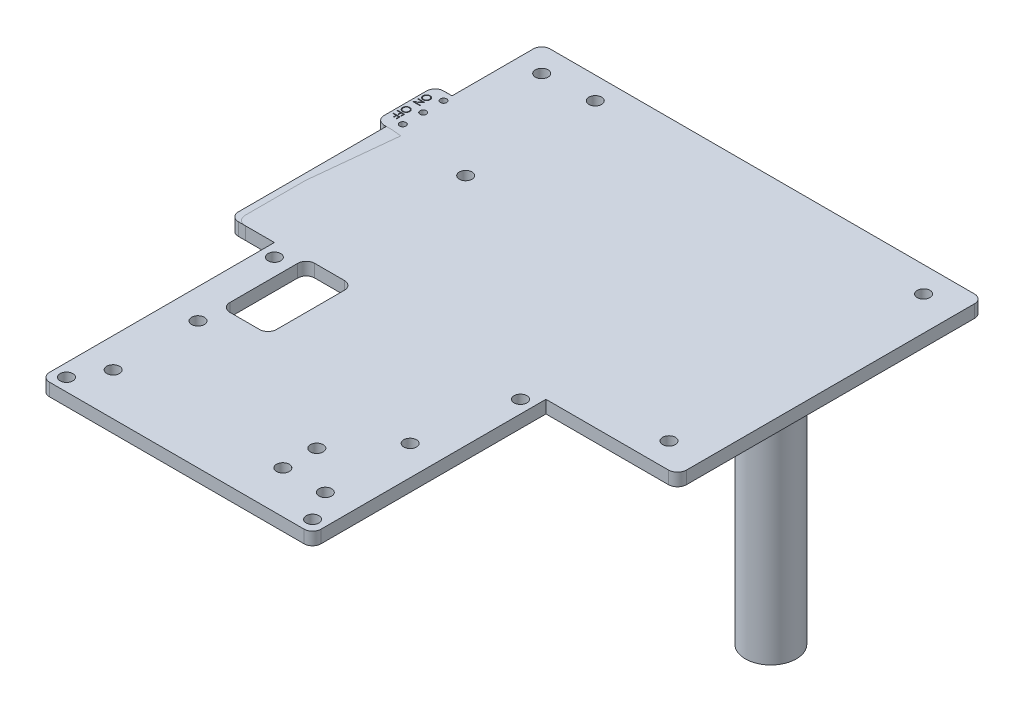
from build123d import *

# Parameters (mm, degrees)
SKETCH1_R           = 1.5
BOSS_EXTRUDE1_DEPTH = 3
BOSS_EXTRUDE2_DEPTH = 3
SKETCH3_R           = 1.5
CUT_EXTRUDE1_DEPTH  = 3
SKETCH4_R           = 6
SKETCH4_R_2         = 1.5
BOSS_EXTRUDE3_DEPTH = 50
SKETCH8_R           = 1.5
CUT_EXTRUDE3_DEPTH  = 130.144299139
SKETCH5_R           = 1.5
CUT_EXTRUDE4_DEPTH  = 130.144299139
SKETCH10_W          = 9
SKETCH10_H          = 4
CUT_EXTRUDE5_DEPTH  = 9
SKETCH11_R          = 1.5
BOSS_EXTRUDE4_DEPTH = 40
SKETCH13_R          = 0.75
BOSS_EXTRUDE6_DEPTH = 3
SKETCH17_R          = 0.75
CUT_EXTRUDE9_DEPTH  = 3
CUT_EXTRUDE10_DEPTH = 3
CUT_EXTRUDE11_DEPTH = 3
SKETCH22_R          = 1.5
CUT_EXTRUDE12_DEPTH = 3
BOSS_EXTRUDE8_DEPTH = 3


with BuildPart() as part:
    # Sketch1 → Boss-Extrude1 (new body)
    with BuildSketch(Plane(origin=(0, 0, 0), x_dir=(1, 0, 0), z_dir=(0, 1, 0))):
        with BuildLine():
            Line((30, 27.5), (-30, 27.5))
            Line((-30, 27.5), (-32, 27.5))
            Line((-32, 27.5), (-32, 25.5))
            Line((-32, 25.5), (-32, -25.5))
            ThreePointArc((-32, -25.5), (-31.414213562, -26.914213562), (-30, -27.5))
            Line((-30, -27.5), (30, -27.5))
            ThreePointArc((30, -27.5), (31.414213562, -26.914213562), (32, -25.5))
            Line((32, -25.5), (32, 25.5))
            Line((32, 25.5), (32, 27.5))
            Line((32, 27.5), (30, 27.5))
        make_face()
        with Locations((-29, 24.5)):
            Circle(SKETCH1_R, mode=Mode.SUBTRACT)
        with Locations((29, 24.5)):
            Circle(SKETCH1_R, mode=Mode.SUBTRACT)
        with Locations((29, -24.5)):
            Circle(SKETCH1_R, mode=Mode.SUBTRACT)
        with Locations((-29, -24.5)):
            Circle(SKETCH1_R, mode=Mode.SUBTRACT)
    extrude(amount=BOSS_EXTRUDE1_DEPTH)

    # Sketch2 → Boss-Extrude2 (add)
    with BuildSketch(Plane(origin=(0, 3, 0), x_dir=(1, 0, 0), z_dir=(0, 1, 0))):
        with BuildLine():
            Line((-41, 97.5), (-41, 29.649557683))
            ThreePointArc((-41, 29.649557683), (-40.370409131, 28.129590869), (-38.850442317, 27.5))
            Line((-38.850442317, 27.5), (-32, 27.5))
            Line((-32, 27.5), (-30, 27.5))
            Line((-30, 27.5), (30, 27.5))
            Line((30, 27.5), (32, 27.5))
            Line((32, 27.5), (60.850442317, 27.5))
            ThreePointArc((60.850442317, 27.5), (62.370409131, 28.129590869), (63, 29.649557683))
            Line((63, 29.649557683), (63, 97.5))
            ThreePointArc((63, 97.5), (62.414213562, 98.914213562), (61, 99.5))
            Line((61, 99.5), (-39, 99.5))
            ThreePointArc((-39, 99.5), (-40.414213562, 98.914213562), (-41, 97.5))
        make_face()
    extrude(amount=-BOSS_EXTRUDE2_DEPTH)

    # Sketch3 → Cut-Extrude1 (cut)
    with BuildSketch(Plane(origin=(0, 3, 0), x_dir=(1, 0, 0), z_dir=(0, 1, 0))):
        with Locations((-36.5, 57)):
            Circle(SKETCH3_R)
        with Locations((55.5, 57)):
            Circle(SKETCH3_R)
    extrude(amount=-CUT_EXTRUDE1_DEPTH, mode=Mode.SUBTRACT)

    # Sketch4 → Boss-Extrude3 (add)
    # profile 1 of 2: a face of its own
    with BuildSketch(Plane.XZ):
        with Locations((-36.5, -57)):
            Circle(SKETCH4_R)
        with Locations((-36.5, -57)):
            Circle(SKETCH4_R_2, mode=Mode.SUBTRACT)
    # profile 2 of 2: a face of its own
    with BuildSketch(Plane.XZ):
        with Locations((55.5, -57)):
            Circle(SKETCH4_R)
        with Locations((55.5, -57)):
            Circle(SKETCH4_R_2, mode=Mode.SUBTRACT)
    extrude(amount=BOSS_EXTRUDE3_DEPTH)

    # Sketch8 → Cut-Extrude3 (cut, through all)
    with BuildSketch(Plane(origin=(0, 3, 0), x_dir=(1, 0, 0), z_dir=(0, 1, 0))):
        with Locations((-25, 2.5)):
            Circle(SKETCH8_R)
        with Locations((-25, -17.5)):
            Circle(SKETCH8_R)
        with Locations((25, -17.5)):
            Circle(SKETCH8_R)
        with Locations((25, 2.5)):
            Circle(SKETCH8_R)
    extrude(amount=-CUT_EXTRUDE3_DEPTH, mode=Mode.SUBTRACT)

    # Sketch5 → Cut-Extrude4 (cut, through all)
    with BuildSketch(Plane(origin=(0, 3, 0), x_dir=(1, 0, 0), z_dir=(0, 1, 0))):
        with Locations((55, 33.5)):
            Circle(SKETCH5_R)
        with Locations((55, 93.5)):
            Circle(SKETCH5_R)
        with Locations((-23.11, 63.7)):
            Circle(SKETCH5_R)
        with Locations((-35, 93.5)):
            Circle(SKETCH5_R)
        with Locations((-23.11, 94.24)):
            Circle(SKETCH5_R)
    extrude(amount=-CUT_EXTRUDE4_DEPTH, mode=Mode.SUBTRACT)

    # Sketch10 → Cut-Extrude5 (cut)
    with BuildSketch(Plane(origin=(0, 0, -63), x_dir=(-1, 0, 0), z_dir=(0, 0, -1))):
        with Locations((-55.5, -42)):
            Rectangle(SKETCH10_W, SKETCH10_H)
        with Locations((35.5, -42)):
            Rectangle(SKETCH10_W, SKETCH10_H)
    extrude(amount=-CUT_EXTRUDE5_DEPTH, mode=Mode.SUBTRACT)

    # Sketch11 → Boss-Extrude4 (add)
    with BuildSketch(Plane(origin=(0, 3, 0), x_dir=(1, 0, 0), z_dir=(0, 1, 0))):
        with Locations((55.5, 57)):
            Circle(SKETCH11_R)
        with Locations((-36.5, 57)):
            Circle(SKETCH11_R)
    extrude(amount=-BOSS_EXTRUDE4_DEPTH)

    # Sketch13 → Boss-Extrude6 (add)
    with BuildSketch(Plane(origin=(0, 3, 0), x_dir=(1, 0, 0), z_dir=(0, 1, 0))):
        with BuildLine():
            Line((-37, 78.374778842), (-43, 78.374778842))
            ThreePointArc((-43, 78.374778842), (-44.414213562, 77.788992404), (-45, 76.374778842))
            Line((-45, 76.374778842), (-45, 66.374778842))
            ThreePointArc((-45, 66.374778842), (-44.414213562, 64.960565279), (-43, 64.374778842))
            Line((-43, 64.374778842), (-37, 64.374778842))
            Line((-37, 64.374778842), (-37, 78.374778842))
        make_face()
        with Locations((-41, 71.574778842)):
            Circle(SKETCH13_R, mode=Mode.SUBTRACT)
        with Locations((-41, 76.374778842)):
            Circle(SKETCH13_R, mode=Mode.SUBTRACT)
        with Locations((-41, 66.774778842)):
            Circle(SKETCH13_R, mode=Mode.SUBTRACT)
    extrude(amount=-BOSS_EXTRUDE6_DEPTH)

    # Sketch17 → Cut-Extrude9 (cut)
    with BuildSketch(Plane(origin=(0, 3, 0), x_dir=(1, 0, 0), z_dir=(0, 1, 0))):
        with Locations((-41, 76.374778842)):
            Circle(SKETCH17_R)
        with Locations((-41, 71.574778842)):
            Circle(SKETCH17_R)
        with Locations((-41, 66.774778842)):
            Circle(SKETCH17_R)
    extrude(amount=-CUT_EXTRUDE9_DEPTH, mode=Mode.SUBTRACT)

    # Sketch18 → Cut-Extrude10 (cut)
    # profile 1 of 5: a face of its own
    with BuildSketch(Plane(origin=(0, 3, 0), x_dir=(1, 0, 0), z_dir=(0, 1, 0))):
        with BuildLine():
            add(Edge.make_bspline(
                [(-42.773187921, 74.988992404), (-42.773938319, 74.959365847), (-42.775412161, 74.901176845), (-42.78669394, 74.815656807), (-42.806212188, 74.734013646), (-42.832205396, 74.65558045), (-42.866886483, 74.581302128), (-42.908781713, 74.51059439), (-42.958486936, 74.443657155), (-43.015168119, 74.381103983), (-43.077064363, 74.324072038), (-43.143309232, 74.27424362), (-43.212995607, 74.23211407), (-43.286365977, 74.197583431), (-43.363097414, 74.170469322), (-43.443626198, 74.151765157), (-43.527423203, 74.139815828), (-43.584578388, 74.138418965), (-43.613572537, 74.137710353)],
                knots=[0, 0, 0, 0, 1.06508495, 2.091914715, 3.094501328, 4.079693967, 5.057647778, 6.035986298, 7.030177474, 8.050107388, 9.066943579, 10.051896531, 11.025616101, 11.9896488, 12.96281505, 13.945825876, 14.957941789, 16, 16, 16, 16], degree=3))
            add(Edge.make_bspline(
                [(-43.613572537, 74.137710353), (-43.642353108, 74.13841886), (-43.69908295, 74.13981541), (-43.782348168, 74.151778757), (-43.862390936, 74.170538604), (-43.93906986, 74.197331913), (-44.01249466, 74.231696667), (-44.082309125, 74.274110952), (-44.14901268, 74.323609473), (-44.211209402, 74.380444292), (-44.268353386, 74.442325775), (-44.318259273, 74.50875745), (-44.360907539, 74.578375243), (-44.395201334, 74.651701259), (-44.422507336, 74.727918036), (-44.441142084, 74.807724096), (-44.453157663, 74.890763339), (-44.454537743, 74.947389971), (-44.455239203, 74.976171891)],
                knots=[0, 0, 0, 0, 1.04355943, 2.056976533, 3.044937463, 4.02179873, 4.997890911, 5.980248884, 6.980147982, 8.006253959, 9.032111064, 10.031228745, 11.015595249, 11.988180414, 12.962670953, 13.946861971, 14.95644057, 16, 16, 16, 16], degree=3))
            add(Edge.make_bspline(
                [(-44.455239203, 74.976171891), (-44.454531007, 75.005165922), (-44.453134964, 75.062320875), (-44.441164959, 75.146222707), (-44.422453933, 75.2268098), (-44.395688478, 75.303834027), (-44.361227494, 75.377320664), (-44.318880062, 75.447262604), (-44.268979429, 75.513743894), (-44.212220278, 75.576088008), (-44.150309055, 75.633062101), (-44.084314039, 75.683174106), (-44.014862879, 75.725277397), (-43.942241867, 75.759752928), (-43.866638715, 75.787021762), (-43.787577851, 75.805631402), (-43.705502296, 75.817670227), (-43.649619877, 75.819057649), (-43.621264844, 75.819761635)],
                knots=[0, 0, 0, 0, 1.053167129, 2.076072758, 3.073341244, 4.055601477, 5.033424535, 6.017524495, 7.021518915, 8.049444456, 9.077120685, 10.074910483, 11.055688766, 12.022980584, 12.991883888, 13.970269434, 14.970104079, 16, 16, 16, 16], degree=3))
            add(Edge.make_bspline(
                [(-43.621264844, 75.819761635), (-43.60223268, 75.819517454), (-43.564408451, 75.819032173), (-43.508242142, 75.813181245), (-43.452973045, 75.804708254), (-43.398786947, 75.792501612), (-43.345675, 75.776756079), (-43.29374582, 75.75735238), (-43.242571665, 75.735115734), (-43.193126469, 75.708639936), (-43.145332623, 75.679754047), (-43.099787751, 75.648256888), (-43.057305407, 75.613928845), (-43.017202968, 75.577260287), (-42.980164891, 75.537743638), (-42.94538366, 75.495973623), (-42.913219319, 75.451731682), (-42.884347407, 75.404947846), (-42.857828205, 75.356814886), (-42.835686853, 75.306983595), (-42.816116868, 75.256505363), (-42.800564533, 75.204935559), (-42.788187892, 75.152393471), (-42.779778277, 75.098813416), (-42.773914348, 75.044250581), (-42.773431105, 75.007491046), (-42.773187921, 74.988992404)],
                knots=[0, 0, 0, 0, 1.037115869, 2.061148057, 3.07517727, 4.084041727, 5.086514338, 6.092668487, 7.104487461, 8.125783165, 9.147610153, 10.147694368, 11.141876323, 12.122903372, 13.107606018, 14.091946891, 15.084523921, 16.086505767, 17.087268121, 18.077809654, 19.05670789, 20.036870126, 21.011670792, 21.99694167, 22.991993299, 24, 24, 24, 24], degree=3))
        make_face()
        with BuildLine():
            add(Edge.make_bspline(
                [(-42.937290485, 74.981941122), (-42.93747549, 74.997124989), (-42.937843731, 75.027347564), (-42.942697932, 75.072277126), (-42.949609547, 75.116618225), (-42.959493687, 75.160368449), (-42.972836917, 75.203292362), (-42.988559067, 75.245818616), (-43.007053795, 75.287743016), (-43.028619107, 75.328596877), (-43.052176869, 75.368311911), (-43.078032329, 75.406044498), (-43.106060116, 75.441418229), (-43.135890001, 75.47454642), (-43.167825491, 75.505332535), (-43.201356895, 75.53440063), (-43.237449495, 75.560580794), (-43.275122741, 75.584574259), (-43.314328057, 75.606045256), (-43.35465256, 75.625137994), (-43.396425218, 75.640755825), (-43.439192832, 75.653492912), (-43.482887671, 75.664052825), (-43.527841202, 75.670742619), (-43.573827539, 75.675648841), (-43.604904958, 75.675996199), (-43.620623819, 75.676171891)],
                knots=[0, 0, 0, 0, 1.008585988, 2.007529826, 2.999688727, 3.990042337, 4.984966365, 5.984641633, 7.001812546, 8.027570247, 9.052811818, 10.068991095, 11.064725446, 12.050001529, 13.029093193, 14.010961114, 14.996492974, 15.989185205, 16.977398719, 17.96520407, 18.951579521, 19.937648295, 20.929603947, 21.935788061, 22.955928099, 24, 24, 24, 24], degree=3))
            add(Edge.make_bspline(
                [(-43.620623819, 75.676171891), (-43.643737977, 75.675589097), (-43.689210676, 75.674442561), (-43.755847542, 75.664404815), (-43.819887902, 75.648943341), (-43.880981346, 75.626151402), (-43.939653018, 75.597648263), (-43.995382437, 75.562435971), (-44.048184666, 75.520717532), (-44.097691074, 75.473328491), (-44.142877728, 75.421523825), (-44.182541, 75.366514577), (-44.216099972, 75.308890071), (-44.243439433, 75.248500035), (-44.265103313, 75.185666875), (-44.279950688, 75.119985708), (-44.289722324, 75.05189407), (-44.290660727, 75.005480056), (-44.291136639, 74.981941122)],
                knots=[0, 0, 0, 0, 1.032063989, 2.030389145, 3.003944642, 3.970395727, 4.937377036, 5.913328081, 6.909231446, 7.93887556, 8.970685674, 9.976071282, 10.964166581, 11.944589148, 12.933237628, 13.927779006, 14.949070134, 16, 16, 16, 16], degree=3))
            add(Edge.make_bspline(
                [(-44.291136639, 74.981941122), (-44.290919267, 74.966119635), (-44.290488151, 74.934740875), (-44.286145889, 74.888068642), (-44.279182784, 74.842237206), (-44.269157211, 74.797310999), (-44.256610399, 74.75334046), (-44.241702215, 74.710144099), (-44.223111847, 74.668174411), (-44.202538737, 74.626930707), (-44.179253954, 74.587445096), (-44.153759902, 74.549982845), (-44.126233361, 74.51476114), (-44.096662515, 74.48170369), (-44.065302271, 74.450704262), (-44.031346306, 74.422604619), (-43.995786291, 74.396110821), (-43.958025172, 74.372213428), (-43.918737239, 74.350785119), (-43.878259992, 74.332151876), (-43.836732539, 74.316334212), (-43.794084495, 74.303567514), (-43.750399662, 74.293562565), (-43.705618792, 74.286668932), (-43.659831673, 74.281846777), (-43.628863052, 74.281483315), (-43.613252024, 74.281300096)],
                knots=[0, 0, 0, 0, 1.047226202, 2.076964084, 3.100341814, 4.114585567, 5.122123135, 6.126552355, 7.137064942, 8.158803602, 9.176592812, 10.169297945, 11.156925011, 12.133779169, 13.104132798, 14.073170763, 15.049307625, 16.038276215, 17.028988595, 18.010110019, 18.986169996, 19.968539974, 20.955178716, 21.950601663, 22.966915103, 24, 24, 24, 24], degree=3))
            add(Edge.make_bspline(
                [(-43.613252024, 74.281300096), (-43.597747793, 74.281483462), (-43.566992296, 74.281847202), (-43.521524493, 74.286666619), (-43.477065883, 74.293569883), (-43.433791001, 74.30351855), (-43.391688818, 74.316341477), (-43.350798876, 74.332152828), (-43.310968844, 74.350797537), (-43.272297166, 74.372195582), (-43.235188714, 74.39624853), (-43.199713326, 74.422531613), (-43.166537214, 74.451498629), (-43.134841359, 74.482321956), (-43.105301735, 74.515771498), (-43.077908646, 74.551695765), (-43.052000623, 74.58965852), (-43.02862986, 74.629854092), (-43.007042755, 74.671336053), (-42.988563596, 74.713906077), (-42.972768921, 74.757156488), (-42.959548303, 74.800865846), (-42.949599863, 74.845342067), (-42.942700412, 74.890326146), (-42.937843211, 74.935894973), (-42.937475312, 74.966543699), (-42.937290485, 74.981941122)],
                knots=[0, 0, 0, 0, 1.029967493, 2.04313025, 3.035375922, 4.01889446, 4.991458755, 5.958017022, 6.930036849, 7.912118993, 8.892942568, 9.867138445, 10.843712051, 11.817804417, 12.803729339, 13.806387533, 14.818654169, 15.856205545, 16.894655496, 17.924916651, 18.938004761, 19.953404357, 20.957695443, 21.963967554, 22.97713031, 24, 24, 24, 24], degree=3))
        make_face(mode=Mode.SUBTRACT)
    # profile 2 of 5: a face of its own
    with BuildSketch(Plane(origin=(0, 3, 0), x_dir=(1, 0, 0), z_dir=(0, 1, 0))):
        Polygon((-44.414213562, 73.809505224), (-42.814213562, 73.809505224), (-42.814213562, 73.779377019), (-44.073508434, 72.722325737), (-42.814213562, 72.722325737), (-42.814213562, 72.578735994), (-44.414213562, 72.578735994), (-44.414213562, 72.611428301), (-43.157803306, 73.665915481), (-44.414213562, 73.665915481), align=None)
    # profile 3 of 5: a face of its own
    with BuildSketch(Plane(origin=(0, 3, 0), x_dir=(1, 0, 0), z_dir=(0, 1, 0))):
        with BuildLine():
            add(Edge.make_bspline(
                [(-42.773187921, 70.188992404), (-42.773938319, 70.159365847), (-42.775412161, 70.101176845), (-42.78669394, 70.015656807), (-42.806212188, 69.934013646), (-42.832205396, 69.85558045), (-42.866886483, 69.781302128), (-42.908781713, 69.71059439), (-42.958486936, 69.643657155), (-43.015168119, 69.581103983), (-43.077064363, 69.524072038), (-43.143309232, 69.47424362), (-43.212995607, 69.43211407), (-43.286365977, 69.397583431), (-43.363097414, 69.370469322), (-43.443626198, 69.351765157), (-43.527423203, 69.339815828), (-43.584578388, 69.338418965), (-43.613572537, 69.337710353)],
                knots=[0, 0, 0, 0, 1.06508495, 2.091914715, 3.094501328, 4.079693967, 5.057647778, 6.035986298, 7.030177474, 8.050107388, 9.066943579, 10.051896531, 11.025616101, 11.9896488, 12.96281505, 13.945825876, 14.957941789, 16, 16, 16, 16], degree=3))
            add(Edge.make_bspline(
                [(-43.613572537, 69.337710353), (-43.642353108, 69.33841886), (-43.69908295, 69.33981541), (-43.782348168, 69.351778757), (-43.862390936, 69.370538604), (-43.93906986, 69.397331913), (-44.01249466, 69.431696667), (-44.082309125, 69.474110952), (-44.14901268, 69.523609473), (-44.211209402, 69.580444292), (-44.268353386, 69.642325775), (-44.318259273, 69.70875745), (-44.360907539, 69.778375243), (-44.395201334, 69.851701259), (-44.422507336, 69.927918036), (-44.441142084, 70.007724096), (-44.453157663, 70.090763339), (-44.454537743, 70.147389971), (-44.455239203, 70.176171891)],
                knots=[0, 0, 0, 0, 1.04355943, 2.056976533, 3.044937463, 4.02179873, 4.997890911, 5.980248884, 6.980147982, 8.006253959, 9.032111064, 10.031228745, 11.015595249, 11.988180414, 12.962670953, 13.946861971, 14.95644057, 16, 16, 16, 16], degree=3))
            add(Edge.make_bspline(
                [(-44.455239203, 70.176171891), (-44.454531007, 70.205165922), (-44.453134964, 70.262320875), (-44.441164959, 70.346222707), (-44.422453933, 70.4268098), (-44.395688478, 70.503834027), (-44.361227494, 70.577320664), (-44.318880062, 70.647262604), (-44.268979429, 70.713743894), (-44.212220278, 70.776088008), (-44.150309055, 70.833062101), (-44.084314039, 70.883174106), (-44.014862879, 70.925277397), (-43.942241867, 70.959752928), (-43.866638715, 70.987021762), (-43.787577851, 71.005631402), (-43.705502296, 71.017670227), (-43.649619877, 71.019057649), (-43.621264844, 71.019761635)],
                knots=[0, 0, 0, 0, 1.053167129, 2.076072758, 3.073341244, 4.055601477, 5.033424535, 6.017524495, 7.021518915, 8.049444456, 9.077120685, 10.074910483, 11.055688766, 12.022980584, 12.991883888, 13.970269434, 14.970104079, 16, 16, 16, 16], degree=3))
            add(Edge.make_bspline(
                [(-43.621264844, 71.019761635), (-43.60223268, 71.019517454), (-43.564408451, 71.019032173), (-43.508242142, 71.013181245), (-43.452973045, 71.004708254), (-43.398786947, 70.992501612), (-43.345675, 70.976756079), (-43.29374582, 70.95735238), (-43.242571665, 70.935115734), (-43.193126469, 70.908639936), (-43.145332623, 70.879754047), (-43.099787751, 70.848256888), (-43.057305407, 70.813928845), (-43.017202968, 70.777260287), (-42.980164891, 70.737743638), (-42.94538366, 70.695973623), (-42.913219319, 70.651731682), (-42.884347407, 70.604947846), (-42.857828205, 70.556814886), (-42.835686853, 70.506983595), (-42.816116868, 70.456505363), (-42.800564533, 70.404935559), (-42.788187892, 70.352393471), (-42.779778277, 70.298813416), (-42.773914348, 70.244250581), (-42.773431105, 70.207491046), (-42.773187921, 70.188992404)],
                knots=[0, 0, 0, 0, 1.037115869, 2.061148057, 3.07517727, 4.084041727, 5.086514338, 6.092668487, 7.104487461, 8.125783165, 9.147610153, 10.147694368, 11.141876323, 12.122903372, 13.107606018, 14.091946891, 15.084523921, 16.086505767, 17.087268121, 18.077809654, 19.05670789, 20.036870126, 21.011670792, 21.99694167, 22.991993299, 24, 24, 24, 24], degree=3))
        make_face()
        with BuildLine():
            add(Edge.make_bspline(
                [(-42.937290485, 70.181941122), (-42.93747549, 70.197124989), (-42.937843731, 70.227347564), (-42.942697932, 70.272277126), (-42.949609547, 70.316618225), (-42.959493687, 70.360368449), (-42.972836917, 70.403292362), (-42.988559067, 70.445818616), (-43.007053795, 70.487743016), (-43.028619107, 70.528596877), (-43.052176869, 70.568311911), (-43.078032329, 70.606044498), (-43.106060116, 70.641418229), (-43.135890001, 70.67454642), (-43.167825491, 70.705332535), (-43.201356895, 70.73440063), (-43.237449495, 70.760580794), (-43.275122741, 70.784574259), (-43.314328057, 70.806045256), (-43.35465256, 70.825137994), (-43.396425218, 70.840755825), (-43.439192832, 70.853492912), (-43.482887671, 70.864052825), (-43.527841202, 70.870742619), (-43.573827539, 70.875648841), (-43.604904958, 70.875996199), (-43.620623819, 70.876171891)],
                knots=[0, 0, 0, 0, 1.008585988, 2.007529826, 2.999688727, 3.990042337, 4.984966365, 5.984641633, 7.001812546, 8.027570247, 9.052811818, 10.068991095, 11.064725446, 12.050001529, 13.029093193, 14.010961114, 14.996492974, 15.989185205, 16.977398719, 17.96520407, 18.951579521, 19.937648295, 20.929603947, 21.935788061, 22.955928099, 24, 24, 24, 24], degree=3))
            add(Edge.make_bspline(
                [(-43.620623819, 70.876171891), (-43.643737977, 70.875589097), (-43.689210676, 70.874442561), (-43.755847542, 70.864404815), (-43.819887902, 70.848943341), (-43.880981346, 70.826151402), (-43.939653018, 70.797648263), (-43.995382437, 70.762435971), (-44.048184666, 70.720717532), (-44.097691074, 70.673328491), (-44.142877728, 70.621523825), (-44.182541, 70.566514577), (-44.216099972, 70.508890071), (-44.243439433, 70.448500035), (-44.265103313, 70.385666875), (-44.279950688, 70.319985708), (-44.289722324, 70.25189407), (-44.290660727, 70.205480056), (-44.291136639, 70.181941122)],
                knots=[0, 0, 0, 0, 1.032063989, 2.030389145, 3.003944642, 3.970395727, 4.937377036, 5.913328081, 6.909231446, 7.93887556, 8.970685674, 9.976071282, 10.964166581, 11.944589148, 12.933237628, 13.927779006, 14.949070134, 16, 16, 16, 16], degree=3))
            add(Edge.make_bspline(
                [(-44.291136639, 70.181941122), (-44.290919267, 70.166119635), (-44.290488151, 70.134740875), (-44.286145889, 70.088068642), (-44.279182784, 70.042237206), (-44.269157211, 69.997310999), (-44.256610399, 69.95334046), (-44.241702215, 69.910144099), (-44.223111847, 69.868174411), (-44.202538737, 69.826930707), (-44.179253954, 69.787445096), (-44.153759902, 69.749982845), (-44.126233361, 69.71476114), (-44.096662515, 69.68170369), (-44.065302271, 69.650704262), (-44.031346306, 69.622604619), (-43.995786291, 69.596110821), (-43.958025172, 69.572213428), (-43.918737239, 69.550785119), (-43.878259992, 69.532151876), (-43.836732539, 69.516334212), (-43.794084495, 69.503567514), (-43.750399662, 69.493562565), (-43.705618792, 69.486668932), (-43.659831673, 69.481846777), (-43.628863052, 69.481483315), (-43.613252024, 69.481300096)],
                knots=[0, 0, 0, 0, 1.047226202, 2.076964084, 3.100341814, 4.114585567, 5.122123135, 6.126552355, 7.137064942, 8.158803602, 9.176592812, 10.169297945, 11.156925011, 12.133779169, 13.104132798, 14.073170763, 15.049307625, 16.038276215, 17.028988595, 18.010110019, 18.986169996, 19.968539974, 20.955178716, 21.950601663, 22.966915103, 24, 24, 24, 24], degree=3))
            add(Edge.make_bspline(
                [(-43.613252024, 69.481300096), (-43.597747793, 69.481483462), (-43.566992296, 69.481847202), (-43.521524493, 69.486666619), (-43.477065883, 69.493569883), (-43.433791001, 69.50351855), (-43.391688818, 69.516341477), (-43.350798876, 69.532152828), (-43.310968844, 69.550797537), (-43.272297166, 69.572195582), (-43.235188714, 69.59624853), (-43.199713326, 69.622531613), (-43.166537214, 69.651498629), (-43.134841359, 69.682321956), (-43.105301735, 69.715771498), (-43.077908646, 69.751695765), (-43.052000623, 69.78965852), (-43.02862986, 69.829854092), (-43.007042755, 69.871336053), (-42.988563596, 69.913906077), (-42.972768921, 69.957156488), (-42.959548303, 70.000865846), (-42.949599863, 70.045342067), (-42.942700412, 70.090326146), (-42.937843211, 70.135894973), (-42.937475312, 70.166543699), (-42.937290485, 70.181941122)],
                knots=[0, 0, 0, 0, 1.029967493, 2.04313025, 3.035375922, 4.01889446, 4.991458755, 5.958017022, 6.930036849, 7.912118993, 8.892942568, 9.867138445, 10.843712051, 11.817804417, 12.803729339, 13.806387533, 14.818654169, 15.856205545, 16.894655496, 17.924916651, 18.938004761, 19.953404357, 20.957695443, 21.963967554, 22.97713031, 24, 24, 24, 24], degree=3))
        make_face(mode=Mode.SUBTRACT)
    # profile 4 of 5: a face of its own
    with BuildSketch(Plane(origin=(0, 3, 0), x_dir=(1, 0, 0), z_dir=(0, 1, 0))):
        Polygon((-42.814213562, 69.009505224), (-42.814213562, 68.230018045), (-42.978316126, 68.230018045), (-42.978316126, 68.865915481), (-43.470623819, 68.865915481), (-43.470623819, 68.230018045), (-43.634726383, 68.230018045), (-43.634726383, 68.865915481), (-44.414213562, 68.865915481), (-44.414213562, 69.009505224), align=None)
    # profile 5 of 5: a face of its own
    with BuildSketch(Plane(origin=(0, 3, 0), x_dir=(1, 0, 0), z_dir=(0, 1, 0))):
        Polygon((-42.814213562, 67.942838558), (-42.814213562, 67.163351378), (-42.978316126, 67.163351378), (-42.978316126, 67.799248814), (-43.470623819, 67.799248814), (-43.470623819, 67.163351378), (-43.634726383, 67.163351378), (-43.634726383, 67.799248814), (-44.414213562, 67.799248814), (-44.414213562, 67.942838558), align=None)
    extrude(amount=-CUT_EXTRUDE10_DEPTH, mode=Mode.SUBTRACT)


with BuildPart() as cut_extrude10_piece_1:
    # of the separate pieces the step leaves, piece 1, a body of its own (cut_extrude10_pieces)
    add(part.part.solids().sort_by_distance((-41, 3, -97.5))[0])

    # Sketch21 → Cut-Extrude11 (cut)
    with BuildSketch(Plane(origin=(0, 3, 0), x_dir=(1, 0, 0), z_dir=(0, 1, 0))):
        with BuildLine():
            Line((-25, 26), (-25, 24.5))
            Line((-25, 24.5), (-25, 10))
            ThreePointArc((-25, 10), (-24.414213562, 8.585786438), (-23, 8))
            Line((-23, 8), (-16, 8))
            ThreePointArc((-16, 8), (-14.585786438, 8.585786438), (-14, 10))
            Line((-14, 10), (-14, 26))
            ThreePointArc((-14, 26), (-14.585786438, 27.414213562), (-16, 28))
            Line((-16, 28), (-23, 28))
            ThreePointArc((-23, 28), (-24.414213562, 27.414213562), (-25, 26))
        make_face()
    extrude(amount=-CUT_EXTRUDE11_DEPTH, mode=Mode.SUBTRACT)

    # Sketch22 → Cut-Extrude12 (cut)
    with BuildSketch(Plane(origin=(0, 3, 0), x_dir=(1, 0, 0), z_dir=(0, 1, 0))):
        with Locations((15, -9.5)):
            Circle(SKETCH22_R)
        with Locations((15, -17.5)):
            Circle(SKETCH22_R)
    extrude(amount=-CUT_EXTRUDE12_DEPTH, mode=Mode.SUBTRACT)


with BuildPart() as cut_extrude10_piece_2:
    # of the separate pieces the step leaves, piece 2, a body of its own (cut_extrude10_pieces)
    add(part.part.solids().sort_by_distance((-43.613252024, 3, -74.281300096))[0])


with BuildPart() as cut_extrude10_piece_3:
    # of the separate pieces the step leaves, piece 3, a body of its own (cut_extrude10_pieces)
    add(part.part.solids().sort_by_distance((-43.613252024, 3, -69.481300096))[0])


with BuildPart() as body_4:
    # Sketch23 → Boss-Extrude8 (new body)
    with BuildSketch(Plane(origin=(0, 3, 0), x_dir=(1, 0, 0), z_dir=(0, 1, 0))):
        with BuildLine():
            Line((-42.5, 57), (-42.5, 29.5))
            ThreePointArc((-42.5, 29.5), (-41.914213562, 28.085786438), (-40.5, 27.5))
            Line((-40.5, 27.5), (-38.850442317, 27.5))
            Line((-38.850442317, 27.5), (-38.850442317, 64.374778842))
            Line((-38.850442317, 64.374778842), (-42.5, 64.374778842))
            Line((-42.5, 64.374778842), (-42.5, 57))
        make_face()
    extrude(amount=-BOSS_EXTRUDE8_DEPTH)


solid = Compound([cut_extrude10_piece_1.part, cut_extrude10_piece_2.part, cut_extrude10_piece_3.part, body_4.part])
